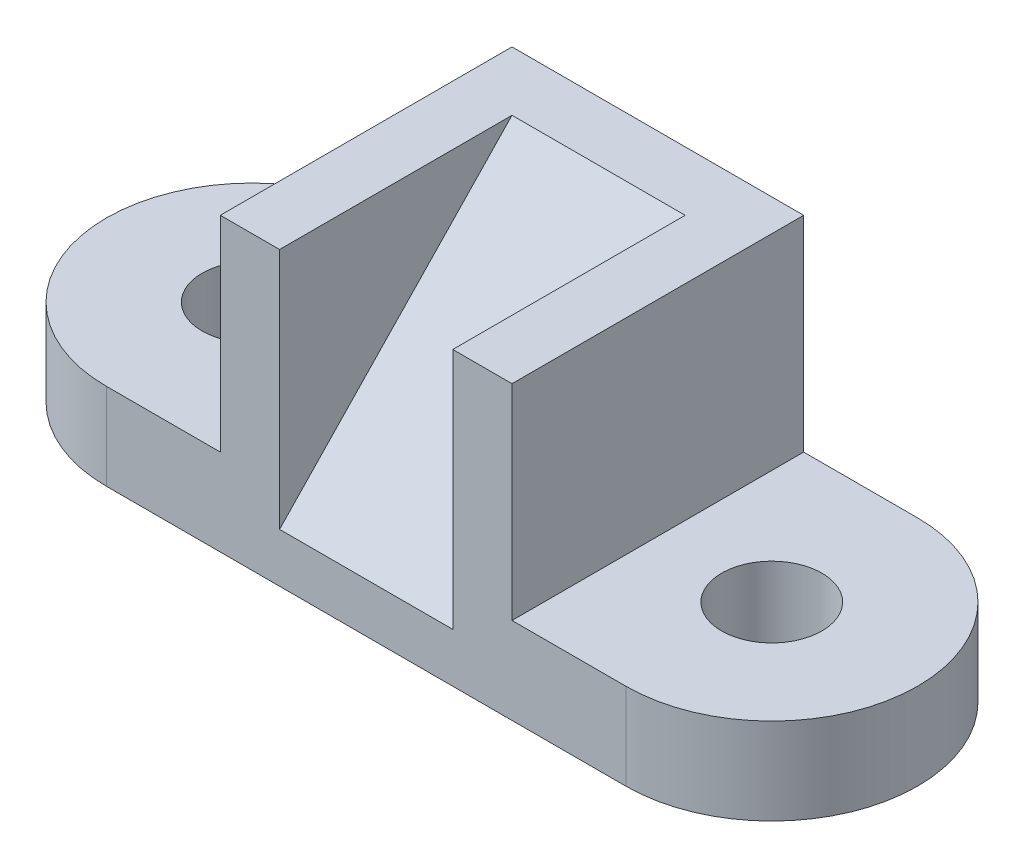
from build123d import *

# Parameters (mm, degrees)
SKETCH2_R           = 11
BOSS_EXTRUDE4_DEPTH = 19
SKETCH3_W           = 64
SKETCH3_H           = 64
BOSS_EXTRUDE5_DEPTH = 45
CUT_EXTRUDE1_START  = -13
CUT_EXTRUDE1_DEPTH  = 38


with BuildPart() as part:
    # Sketch2 → Boss-Extrude4 (new body)
    with BuildSketch(Plane(origin=(0, 0, 0), x_dir=(1, 0, 0), z_dir=(0, 1, 0))):
        with BuildLine():
            Line((-57, 32), (57, 32))
            ThreePointArc((57, 32), (89, 0), (57, -32))
            Line((57, -32), (-57, -32))
            ThreePointArc((-57, -32), (-89, 0), (-57, 32))
        make_face()
        with Locations(Location((-57, 0, 0), (0, 0, 270))):
            Circle(SKETCH2_R, mode=Mode.SUBTRACT)
        with Locations(Location((57, 0, 0), (0, 0, 270))):
            Circle(SKETCH2_R, mode=Mode.SUBTRACT)
    extrude(amount=BOSS_EXTRUDE4_DEPTH)

    # Sketch3 → Boss-Extrude5 (add)
    with BuildSketch(Plane(origin=(0, 19, 0), x_dir=(1, 0, 0), z_dir=(0, 1, 0))):
        Rectangle(SKETCH3_W, SKETCH3_H)
    extrude(amount=BOSS_EXTRUDE5_DEPTH)

    # Sketch6 → Cut-Extrude1 (cut)
    with BuildSketch(Plane.ZY.offset(32).offset(CUT_EXTRUDE1_START)):
        Polygon((-19, 64), (32, 10.813336164), (32, 64), align=None)
    extrude(amount=-CUT_EXTRUDE1_DEPTH, mode=Mode.SUBTRACT)


solid = part.part
